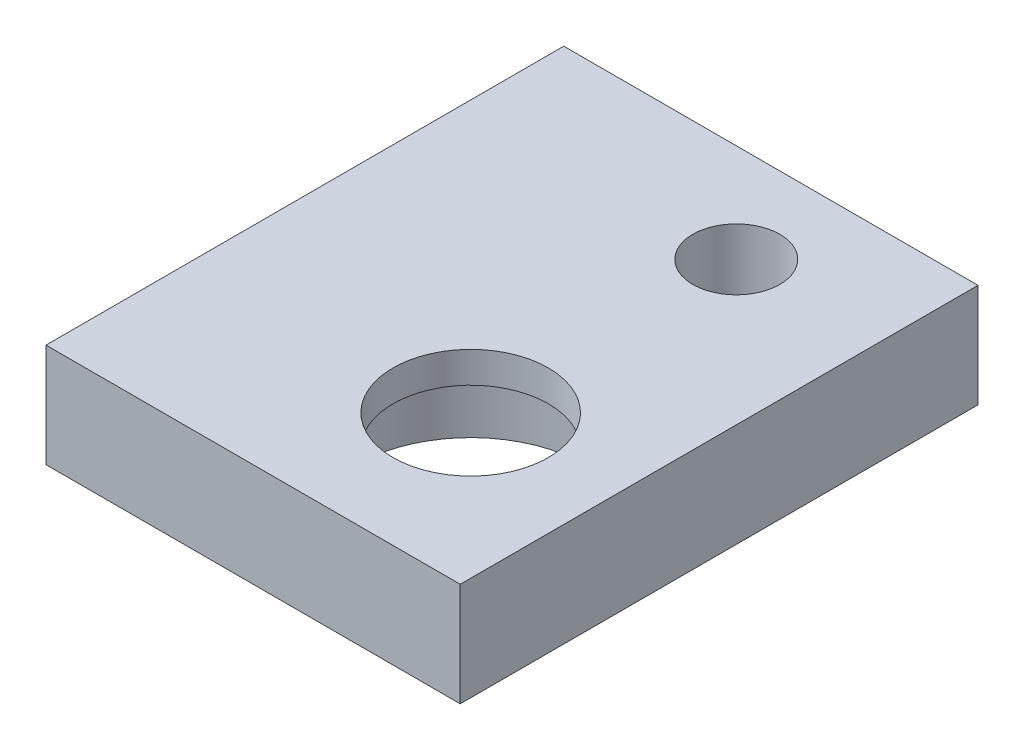
from build123d import *

# Parameters (mm, degrees)
SKETCH2_W           = 40
SKETCH2_H           = 50
BOSS_EXTRUDE1_DEPTH = 10
SKETCH3_R           = 11.2
SKETCH3_R_2         = 7.5
CUT_EXTRUDE1_DEPTH  = 7
SKETCH4_R           = 7.5
SKETCH4_R_2         = 4.2
CUT_EXTRUDE2_DEPTH  = 65.807406984


with BuildPart() as part:
    # Sketch2 → Boss-Extrude1 (new body)
    with BuildSketch(Plane(origin=(0, 0, 0), x_dir=(1, 0, 0), z_dir=(0, 1, 0))):
        with Locations((20, -25)):
            Rectangle(SKETCH2_W, SKETCH2_H)
    extrude(amount=BOSS_EXTRUDE1_DEPTH)

    # Sketch3 → Cut-Extrude1 (cut)
    # profile 1 of 2: a face of its own
    with BuildSketch(Plane.XZ):
        with Locations(Location((26.16, 35.15, 0), (0, 0, 270))):
            Circle(SKETCH3_R)
        with Locations((26.16, 35.15)):
            Circle(SKETCH3_R_2, mode=Mode.SUBTRACT)
    # profile 2 of 2: a face of its own
    with BuildSketch(Plane.XZ):
        with Locations((26.16, 35.15)):
            Circle(SKETCH3_R_2)
    extrude(amount=-CUT_EXTRUDE1_DEPTH, mode=Mode.SUBTRACT)

    # Sketch4 → Cut-Extrude2 (cut, through all)
    with BuildSketch(Plane.XZ):
        with Locations(Location((26.16, 35.15, 0), (0, 0, 270))):
            Circle(SKETCH4_R)
        with Locations(Location((26.16, 9.5, 0), (0, 0, 270))):
            Circle(SKETCH4_R_2)
    extrude(amount=-CUT_EXTRUDE2_DEPTH, mode=Mode.SUBTRACT)


solid = part.part
